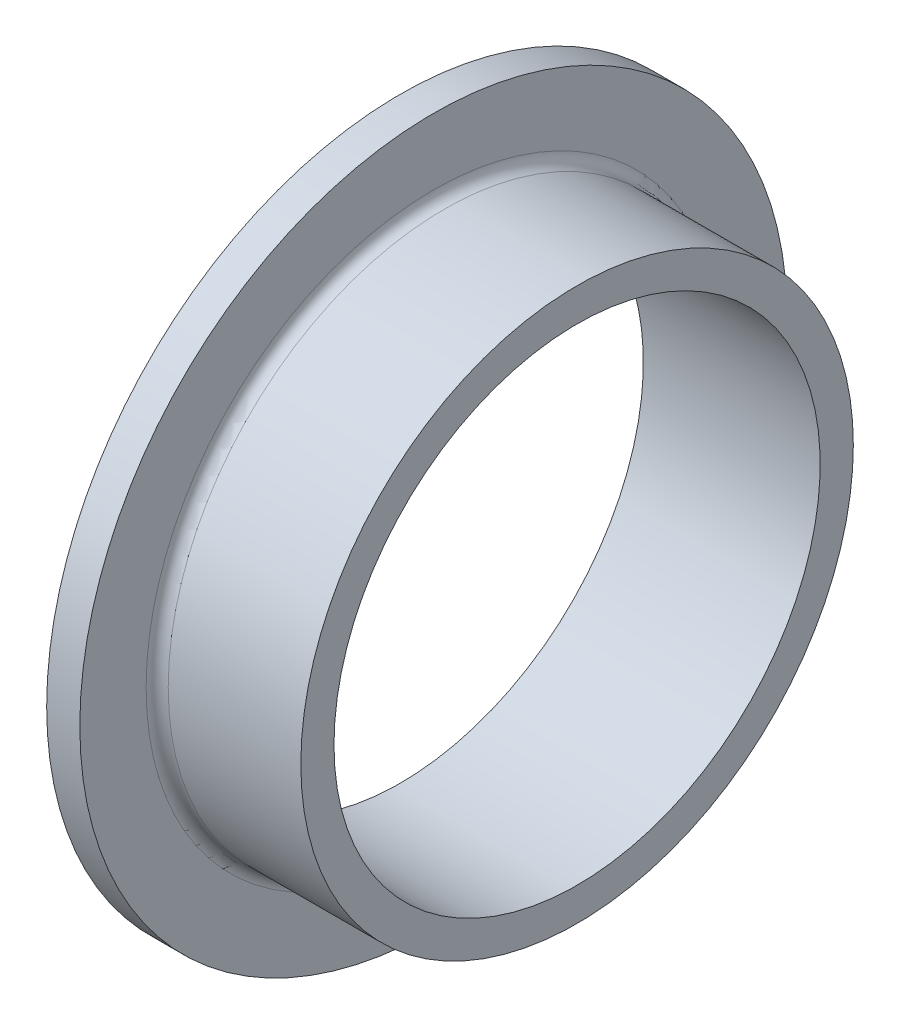
from build123d import *

# Parameters (mm, degrees)
FILLET1_R = 0.5


with BuildPart() as part:
    # Sketch1 → Revolve1 (revolve)
    with BuildSketch(Plane.XY, mode=Mode.PRIVATE) as revolve1_sk:
        Polygon((0, 11), (0, 16), (1.5, 16), (1.5, 12.5), (8, 12.5), (8, 11), align=None)
    revolve(revolve1_sk.sketch.rotate(Axis((0, 0, 0), (1, 0, 0)), 90), axis=Axis((0, 0, 0), (1, 0, 0)))

    # Fillet1
    fillet1_edges = [part.edges().sort_by_distance(p)[0] for p in [
        (1.5, 0, -12.5),
    ]]
    fillet(fillet1_edges, radius=FILLET1_R)


solid = part.part
